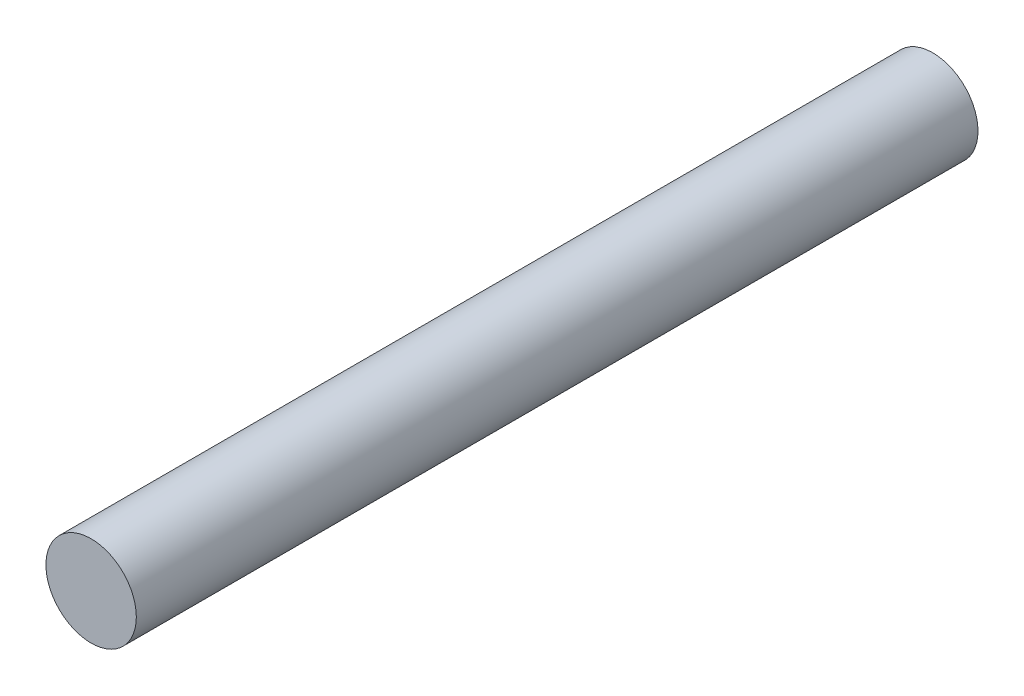
from build123d import *

# Parameters (mm, degrees)
SKETCH1_R           = 3
BOSS_EXTRUDE1_DEPTH = 55.85500005


with BuildPart() as part:
    # Sketch1 → Boss-Extrude1 (new body)
    with BuildSketch(Plane.XY):
        Circle(SKETCH1_R)
    extrude(amount=BOSS_EXTRUDE1_DEPTH)


solid = part.part
